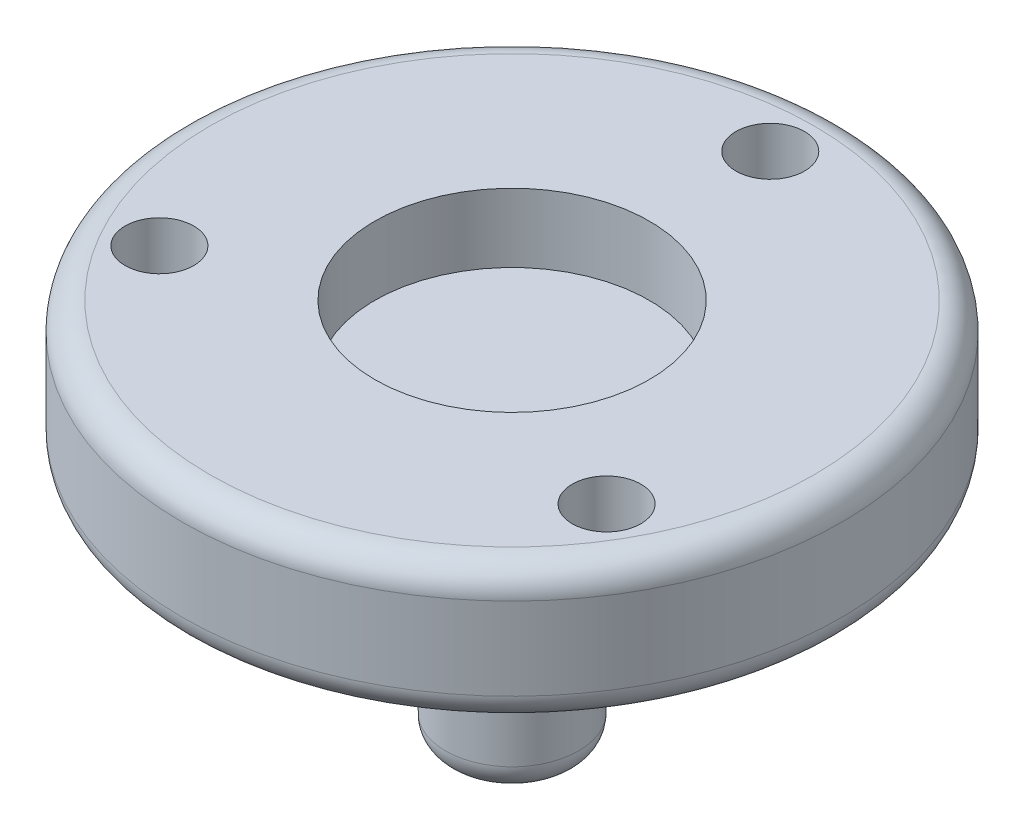
from build123d import *

# Parameters (mm, degrees)
SKETCH1_R           = 15.24
BOSS_EXTRUDE1_DEPTH = 6.35
SKETCH2_R           = 6.35
CUT_EXTRUDE1_DEPTH  = 3.175
FILLET4_R           = 1.27
SKETCH3_R           = 3.0734
BOSS_EXTRUDE3_DEPTH = 11.43
FILLET5_R           = 1.27
SKETCH4_R           = 1.5875
CUT_EXTRUDE2_DEPTH  = 2.54
CIRPATTERN1_COUNT   = 3


with BuildPart() as part:
    # Sketch1 → Boss-Extrude1 (new body)
    with BuildSketch(Plane(origin=(0, 0, 0), x_dir=(1, 0, 0), z_dir=(0, 1, 0))):
        Circle(SKETCH1_R)
    extrude(amount=BOSS_EXTRUDE1_DEPTH)

    # Sketch2 → Cut-Extrude1 (cut)
    with BuildSketch(Plane(origin=(0, 6.35, 0), x_dir=(1, 0, 0), z_dir=(0, 1, 0))):
        Circle(SKETCH2_R)
    extrude(amount=-CUT_EXTRUDE1_DEPTH, mode=Mode.SUBTRACT)

    # Fillet4
    fillet4_edges = [part.edges().sort_by_distance(p)[0] for p in [
        (-15.24, 6.35, 0),
    ]]
    fillet(fillet4_edges, radius=FILLET4_R)

    # Sketch3 → Boss-Extrude3 (add)
    with BuildSketch(Plane.XZ):
        Circle(SKETCH3_R)
    extrude(amount=BOSS_EXTRUDE3_DEPTH)

    # Fillet5
    fillet5_edges = [part.edges().sort_by_distance(p)[0] for p in [
        (-3.0734, -11.43, 0),
        (-15.24, 0, 0),
        (-3.0734, 0, 0),
    ]]
    fillet(fillet5_edges, radius=FILLET5_R)

    # Sketch4 → Cut-Extrude2 (cut)
    with BuildSketch(Plane(origin=(0, 6.35, 0), x_dir=(1, 0, 0), z_dir=(0, 1, 0))):
        with Locations((0, 11.938)):
            Circle(SKETCH4_R)
    cut_extrude2 = extrude(amount=-CUT_EXTRUDE2_DEPTH, mode=Mode.SUBTRACT)

    # CirPattern1: Cut-Extrude2 ×3 about axis
    cirpattern1_axis = Axis((0, 3.175, 0), (0, 1, 0))
    for i in range(1, CIRPATTERN1_COUNT):
        add(cut_extrude2.rotate(cirpattern1_axis, i * 360 / CIRPATTERN1_COUNT), mode=Mode.SUBTRACT)


solid = part.part
